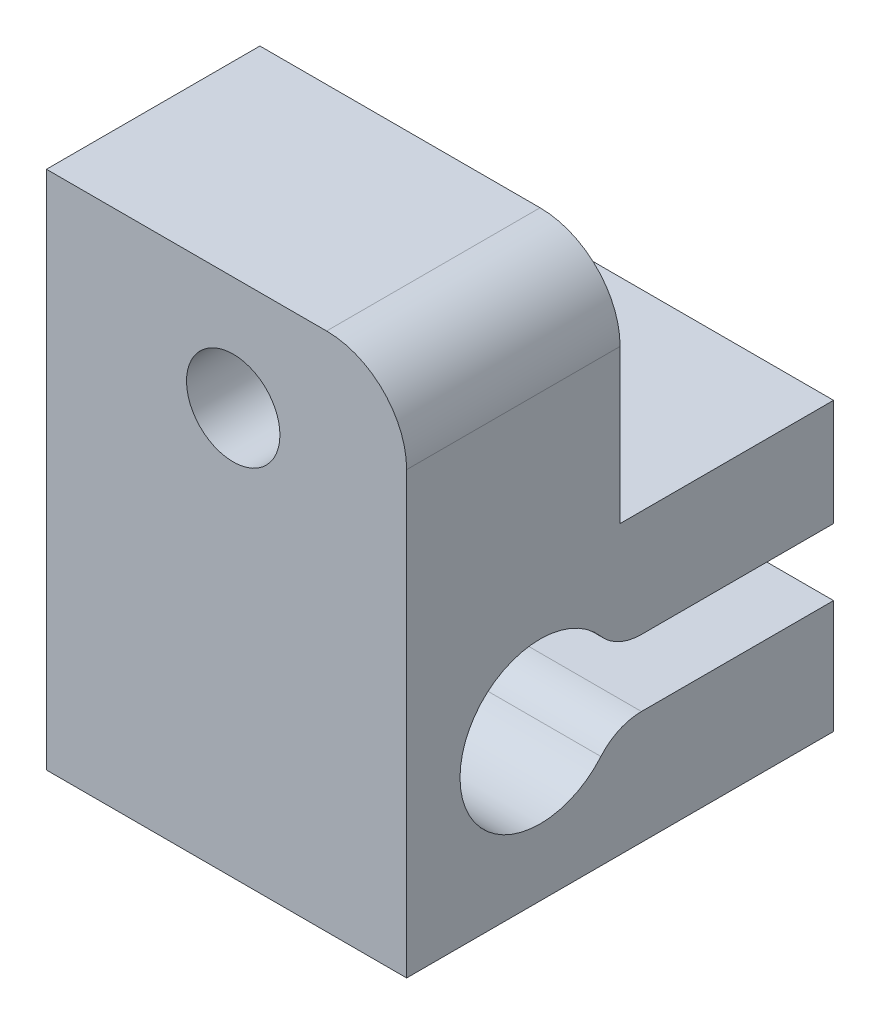
from build123d import *

# Parameters (mm, degrees)
BOSS_EXTRUDE1_DEPTH     = 13.5
SKETCH2_R               = 3
SKETCH2_W               = 11
SKETCH2_H               = 2.5
CUT_EXTRUDE1_DEPTH      = 9
CUT_EXTRUDE2_DEPTH      = 16.493950432
CUT_EXTRUDE2_DEPTH_BACK = 16.493950432
SKETCH3_R               = 1.75
CUT_EXTRUDE4_START      = -2.5
SKETCH4_R               = 1.75
CUT_EXTRUDE4_DEPTH      = 2.5
SKETCH5_R               = 1.75
CUT_EXTRUDE5_DEPTH      = 19.474644787
SKETCH6_R               = 3
SKETCH6_R_2             = 1.75
CUT_EXTRUDE6_DEPTH      = 5
FILLET1_R               = 3
FILLET2_R               = 2


with BuildPart() as part:
    # Sketch1 → Boss-Extrude1 (new body)
    with BuildSketch(Plane(origin=(0, 0, 0), x_dir=(0, 0, -1), z_dir=(1, 0, 0))):
        Polygon((-8, 9.75), (-8, -9.75), (8, -9.75), (8, 1), (0, 1), (0, 9.75), align=None)
    extrude(amount=BOSS_EXTRUDE1_DEPTH)

    # Sketch2 → Cut-Extrude1 (cut)
    with BuildSketch(Plane(origin=(13.5, 0, 0), x_dir=(0, 0, -1), z_dir=(1, 0, 0))):
        with Locations((-3, -4.25)):
            Circle(SKETCH2_R)
        with Locations((2.5, -4.25)):
            Rectangle(SKETCH2_W, SKETCH2_H)
    extrude(amount=-CUT_EXTRUDE1_DEPTH, mode=Mode.SUBTRACT)

    # Sketch3 → Cut-Extrude2 (cut, two sides: drawn at the far end of the back side and taken through both)
    with BuildSketch(Plane(origin=(4.5, 0, 0), x_dir=(0, 0, -1), z_dir=(1, 0, 0)).offset(-CUT_EXTRUDE2_DEPTH_BACK)):
        with Locations((-3, -4.25)):
            Circle(SKETCH3_R)
    extrude(amount=CUT_EXTRUDE2_DEPTH + CUT_EXTRUDE2_DEPTH_BACK, mode=Mode.SUBTRACT)

    # Sketch4 → Cut-Extrude4 (cut)
    with BuildSketch(Plane.ZY.offset(CUT_EXTRUDE4_START)):
        Polygon((6.175426481, -4.25), (4.58771324, -1.5), (1.41228676, -1.5), (-0.175426481, -4.25), (1.41228676, -7), (4.58771324, -7), align=None)
        with Locations(Location((3, -4.25, 0), (0, 0, 180))):
            Circle(SKETCH4_R, mode=Mode.SUBTRACT)
    extrude(amount=CUT_EXTRUDE4_DEPTH, mode=Mode.SUBTRACT)

    # Sketch5 → Cut-Extrude5 (cut, through all)
    with BuildSketch(Plane(origin=(0, 0, 0), x_dir=(-1, 0, 0), z_dir=(0, 0, -1))):
        with Locations(Location((-7, 5.5, 0), (0, 0, 90))):
            Circle(SKETCH5_R)
    extrude(amount=-CUT_EXTRUDE5_DEPTH, mode=Mode.SUBTRACT)

    # Sketch6 → Cut-Extrude6 (cut)
    with BuildSketch(Plane(origin=(0, 0, 0), x_dir=(-1, 0, 0), z_dir=(0, 0, -1))):
        with Locations(Location((-7, 5.5, 0), (0, 0, 90))):
            Circle(SKETCH6_R)
        with Locations(Location((-7, 5.5, 0), (0, 0, 90))):
            Circle(SKETCH6_R_2, mode=Mode.SUBTRACT)
    extrude(amount=-CUT_EXTRUDE6_DEPTH, mode=Mode.SUBTRACT)

    # Fillet1
    fillet1_edges = [part.edges().sort_by_distance(p)[0] for p in [
        (13.5, 9.75, 4),
    ]]
    fillet(fillet1_edges, radius=FILLET1_R)

    # Fillet2
    fillet2_edges = [part.edges().sort_by_distance(p)[0] for p in [
        (9, -3, 0.272821971),
        (9, -5.5, 0.272821971),
    ]]
    fillet(fillet2_edges, radius=FILLET2_R)


solid = part.part
